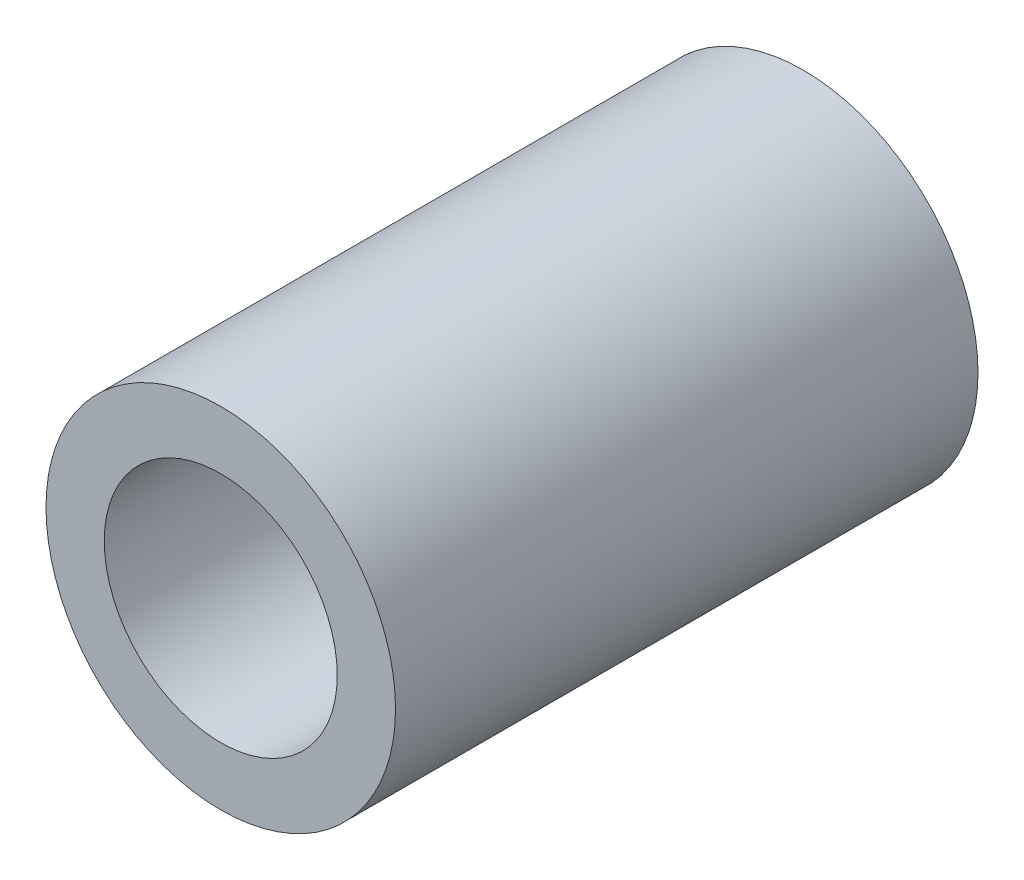
from build123d import *

# Parameters (mm, degrees)
SKETCH1_R           = 3
SKETCH1_R_2         = 2
BOSS_EXTRUDE1_DEPTH = 10


with BuildPart() as part:
    # Sketch1 → Boss-Extrude1 (new body)
    with BuildSketch(Plane.XY):
        Circle(SKETCH1_R)
        Circle(SKETCH1_R_2, mode=Mode.SUBTRACT)
    extrude(amount=BOSS_EXTRUDE1_DEPTH)


solid = part.part
